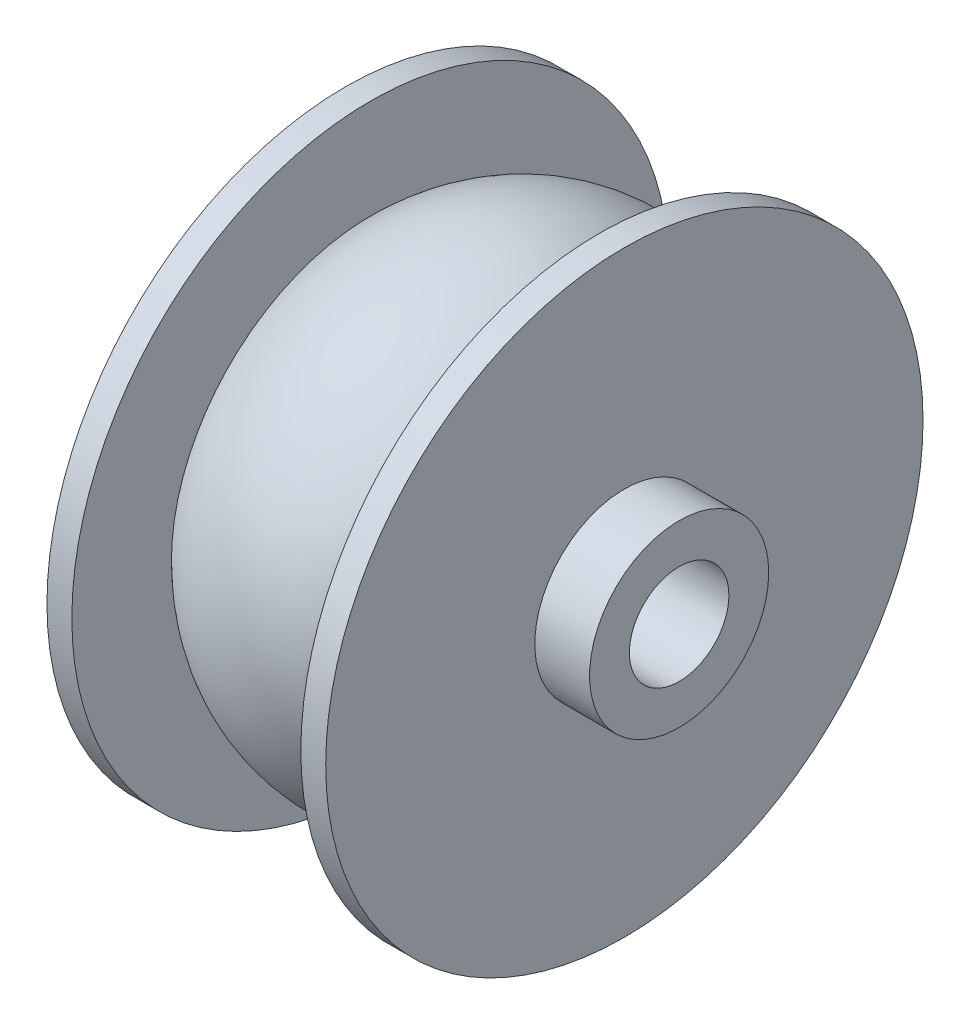
from build123d import *

# Parameters (mm, degrees)
SKETCH1_R           = 6
BOSS_EXTRUDE1_DEPTH = 5.6
SKETCH2_R           = 1
CUT_EXTRUDE1_DEPTH  = 6.7
BOSS_EXTRUDE2_START = 1.1
SKETCH3_R           = 1.8
SKETCH3_R_2         = 1
BOSS_EXTRUDE2_DEPTH = 1.1


with BuildPart() as part:
    # Sketch1 → Boss-Extrude1 (new body)
    with BuildSketch(Plane(origin=(0, 0, 0), x_dir=(0, 0, -1), z_dir=(1, 0, 0))):
        Circle(SKETCH1_R)
    extrude(amount=BOSS_EXTRUDE1_DEPTH)

    # Sketch2 → Cut-Extrude1 (cut)
    with BuildSketch(Plane(origin=(5.6, 0, 0), x_dir=(0, 0, -1), z_dir=(1, 0, 0))):
        Circle(SKETCH2_R)
    extrude(amount=-CUT_EXTRUDE1_DEPTH, mode=Mode.SUBTRACT)

    # Sketch3 → Boss-Extrude2 (add)
    with BuildSketch(Plane(origin=(5.6, 0, 0), x_dir=(0, 0, -1), z_dir=(1, 0, 0)).offset(BOSS_EXTRUDE2_START)):
        Circle(SKETCH3_R)
        Circle(SKETCH3_R_2, mode=Mode.SUBTRACT)
    extrude(amount=-BOSS_EXTRUDE2_DEPTH)

    # Sketch4 → Cut-Revolve1 (revolve, cut)
    with BuildSketch(Plane.XY, mode=Mode.PRIVATE) as cut_revolve1_sk:
        with BuildLine():
            Line((0.5, 6), (0.5, 4))
            ThreePointArc((0.5, 4), (2.8, 4.952691193), (5.1, 4))
            Line((5.1, 4), (5.1, 6))
            Line((5.1, 6), (0.5, 6))
        make_face()
    revolve(cut_revolve1_sk.sketch.rotate(Axis((0, 0, 0), (1, 0, 0)), 90), axis=Axis((0, 0, 0), (1, 0, 0)), mode=Mode.SUBTRACT)


solid = part.part
